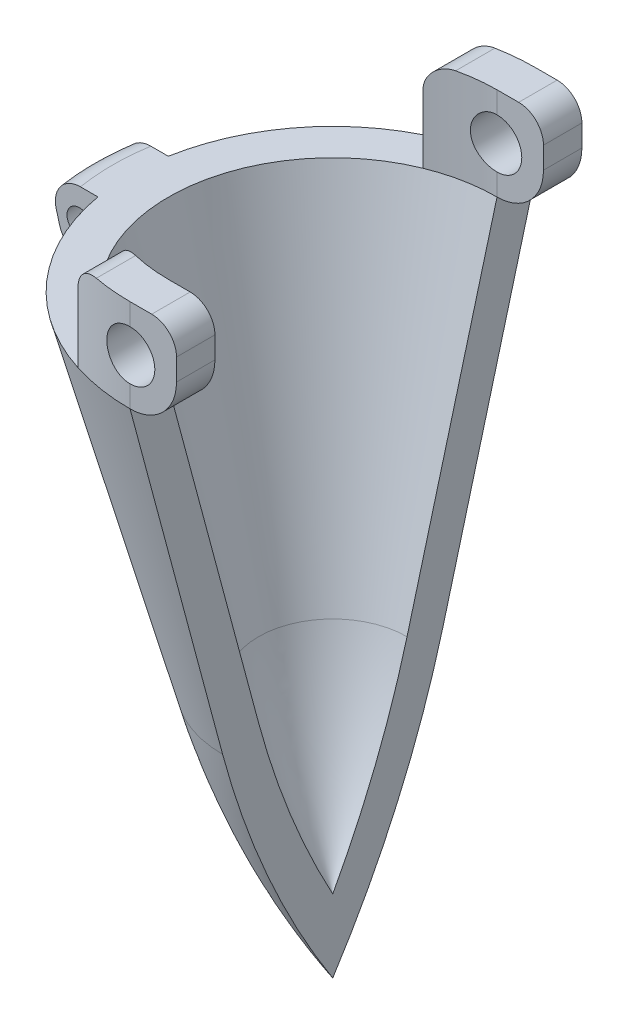
from build123d import *

# Parameters (mm, degrees)
REVOLUCI_N1_ANGLE           = 180
SALIENTE_EXTRUIR1_DEPTH     = 15
CROQUIS4_R                  = 4
CORTAR_EXTRUIR1_DEPTH       = 133.97745807
REVOLUCI_N2_ANGLE           = 10
REVOLUCI_N2_OTHER_WAY_ANGLE = 10
CORTAR_EXTRUIR2_DEPTH       = 10
CROQUIS7_R                  = 2
CORTAR_EXTRUIR3_DEPTH       = 125.332377301
CORTAR_EXTRUIR4_DEPTH       = 136.17013319
REDONDEO1_R                 = 4


with BuildPart() as part:
    # Croquis1 → Revolución1 (revolve)
    with BuildSketch(Plane(origin=(0, 0, 0), x_dir=(0, 0, -1), z_dir=(1, 0, 0))):
        with BuildLine():
            Line((-17.795554958, 40.198460931), (-32.747532288, 96))
            Line((-32.747532288, 96), (-26.535875205, 96))
            Line((-26.535875205, 96), (-12, 41.751375201))
            ThreePointArc((-12, 41.751375201), (-6.891349359, 26.394835458), (0, 11.751375201))
            Line((0, 11.751375201), (0, 0))
            ThreePointArc((0, 0), (-10.458199488, 19.408443431), (-17.795554958, 40.198460931))
        make_face()
    revolve(axis=Axis((0, 11.751375201, 0), (0, -1, 0)), revolution_arc=REVOLUCI_N1_ANGLE)

    # Croquis3 → Saliente-Extruir1 (add)
    with BuildSketch(Plane(origin=(0, 96, 0), x_dir=(1, 0, 0), z_dir=(0, 1, 0))):
        with BuildLine():
            Line((-10, -24.579517345), (-10, -31.183342844))
            ThreePointArc((-10, -31.183342844), (-5.060797581, -32.354121821), (0, -32.747532288))
            Line((0, -32.747532288), (10, -32.747532288))
            Line((10, -32.747532288), (10, -26.535875205))
            Line((10, -26.535875205), (0, -26.535875205))
            ThreePointArc((0, -26.535875205), (-5.094784983, -26.042193435), (-10, -24.579517345))
        make_face()
        with BuildLine():
            Line((-10, 24.579517345), (-10, 31.183342844))
            ThreePointArc((-10, 31.183342844), (-5.060797581, 32.354121821), (0, 32.747532288))
            Line((0, 32.747532288), (10, 32.747532288))
            Line((10, 32.747532288), (10, 26.535875205))
            Line((10, 26.535875205), (0, 26.535875205))
            ThreePointArc((0, 26.535875205), (-5.094784983, 26.042193435), (-10, 24.579517345))
        make_face()
    extrude(amount=SALIENTE_EXTRUIR1_DEPTH)

    # Croquis4 → Cortar-Extruir1 (cut, through all)
    with BuildSketch(Plane.XY.offset(32.747532288)):
        with Locations(Location((0, 103.5, 0), (0, 0, 270))):
            Circle(CROQUIS4_R)
    extrude(amount=-CORTAR_EXTRUIR1_DEPTH, mode=Mode.SUBTRACT)

    # Croquis5 → Revolución2 (revolve)
    with BuildSketch(Plane.XY):
        Polygon((-32.747532288, 96), (-40.747532288, 96), (-38.068040363, 86), (-30.068040363, 86), align=None)
    revolve(axis=Axis((0, 0, 0), (0, 1, 0)), revolution_arc=REVOLUCI_N2_ANGLE)

    # Croquis5 → Revolución2 other way (revolve)
    with BuildSketch(Plane.XY):
        Polygon((-32.747532288, 96), (-40.747532288, 96), (-38.068040363, 86), (-30.068040363, 86), align=None)
    revolve(axis=Axis((0, 0, 0), (0, -1, 0)), revolution_arc=REVOLUCI_N2_OTHER_WAY_ANGLE)

    # Croquis6 → Cortar-Extruir2 (cut)
    with BuildSketch(Plane(origin=(0, 96, 0), x_dir=(1, 0, 0), z_dir=(0, 1, 0))):
        Polygon((-32.250023689, 5.686549305), (-40.348786159, 5.686549305), (-40.128485713, 7.075734726), align=None)
        Polygon((-32.250023689, -5.686549305), (-40.348786159, -5.686549305), (-40.128485713, -7.075734726), align=None)
    extrude(amount=-CORTAR_EXTRUIR2_DEPTH, mode=Mode.SUBTRACT)


with BuildPart() as cortar_extruir2_kept_piece:
    # of the separate pieces the step leaves, the one the design keeps (cortar_extruir2_pieces_kept)
    add(part.part.solids().sort_by_distance((0, 40.198460931, 17.795554958))[0])

    # Croquis7 → Cortar-Extruir3 (cut, through all)
    with BuildSketch(Plane.XY.offset(5.686549305)):
        with Locations((-35.250023689, 91)):
            Circle(CROQUIS7_R)
    extrude(amount=-CORTAR_EXTRUIR3_DEPTH, mode=Mode.SUBTRACT)

    # Croquis8 → Cortar-Extruir4 (cut, through all)
    with BuildSketch(Plane.XY.offset(32.747532288)):
        with BuildLine():
            Line((7.5, 103.5), (7.5, 111))
            Line((7.5, 111), (10, 111))
            Line((10, 111), (10, 96))
            Line((10, 96), (0, 96))
            ThreePointArc((0, 96), (5.303300859, 98.196699141), (7.5, 103.5))
        make_face()
    extrude(amount=-CORTAR_EXTRUIR4_DEPTH, mode=Mode.SUBTRACT)

    # Redondeo1
    redondeo1_edges = [cortar_extruir2_kept_piece.edges().sort_by_distance(p)[0] for p in [
        (7.5, 111, -29.641703747),
        (7.5, 111, 29.641703747),
        (-10, 111, -27.881430095),
        (-10, 111, 27.881430095),
        (-38.068040363, 86, 0),
        (-40.747532288, 96, 0),
    ]]
    fillet(redondeo1_edges, radius=REDONDEO1_R)


solid = cortar_extruir2_kept_piece.part
